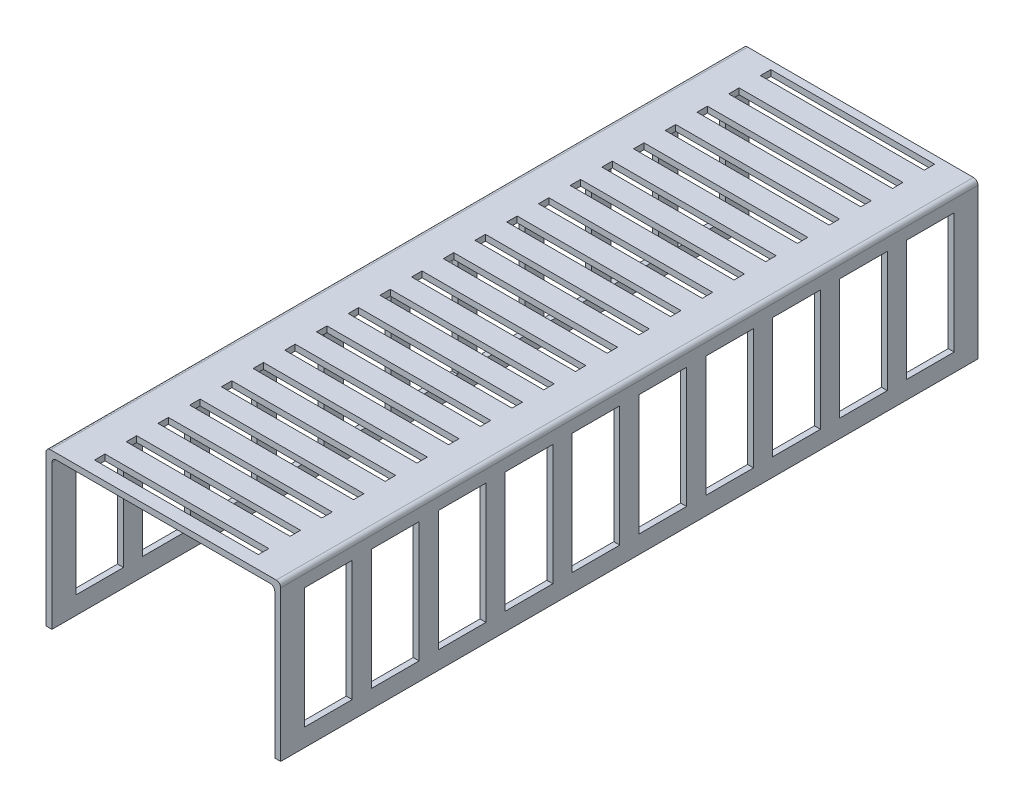
from build123d import *

# Parameters (mm, degrees)
SKETCH2_W           = 78.8
SKETCH2_H           = 234.1
SKETCH2_W_2         = 55
SKETCH2_H_2         = 3.5
BOSS_EXTRUDE1_DEPTH = 2
SKETCH3_W           = 2
SKETCH3_H           = 234.1
BOSS_EXTRUDE2_DEPTH = 50
FILLET1_R           = 1.5
SKETCH4_W           = 16
SKETCH4_H           = 40.5
CUT_EXTRUDE1_DEPTH  = 16103.800045703


with BuildPart() as part:
    # Sketch2 → Boss-Extrude1 (new body)
    with BuildSketch(Plane(origin=(0, 16100.049263041, 0), x_dir=(1, 0, 0), z_dir=(0, 1, 0))):
        with Locations((-7.2, 17)):
            Rectangle(SKETCH2_W, SKETCH2_H)
        with Locations((-7.2, 119.004761905)):
            Rectangle(SKETCH2_W_2, SKETCH2_H_2, mode=Mode.SUBTRACT)
        with Locations((-7.2, 129.65)):
            Rectangle(SKETCH2_W_2, SKETCH2_H_2, mode=Mode.SUBTRACT)
        with Locations((-7.2, 108.35952381)):
            Rectangle(SKETCH2_W_2, SKETCH2_H_2, mode=Mode.SUBTRACT)
        with Locations((-7.2, 97.714285714)):
            Rectangle(SKETCH2_W_2, SKETCH2_H_2, mode=Mode.SUBTRACT)
        with Locations((-7.2, 87.069047619)):
            Rectangle(SKETCH2_W_2, SKETCH2_H_2, mode=Mode.SUBTRACT)
        with Locations((-7.2, 76.423809524)):
            Rectangle(SKETCH2_W_2, SKETCH2_H_2, mode=Mode.SUBTRACT)
        with Locations((-7.2, 65.778571429)):
            Rectangle(SKETCH2_W_2, SKETCH2_H_2, mode=Mode.SUBTRACT)
        with Locations((-7.2, 55.133333333)):
            Rectangle(SKETCH2_W_2, SKETCH2_H_2, mode=Mode.SUBTRACT)
        with Locations((-7.2, 44.488095238)):
            Rectangle(SKETCH2_W_2, SKETCH2_H_2, mode=Mode.SUBTRACT)
        with Locations((-7.2, 33.842857143)):
            Rectangle(SKETCH2_W_2, SKETCH2_H_2, mode=Mode.SUBTRACT)
        with Locations((-7.2, 23.197619048)):
            Rectangle(SKETCH2_W_2, SKETCH2_H_2, mode=Mode.SUBTRACT)
        with Locations((-7.2, 12.552380952)):
            Rectangle(SKETCH2_W_2, SKETCH2_H_2, mode=Mode.SUBTRACT)
        with Locations((-7.2, 1.907142857)):
            Rectangle(SKETCH2_W_2, SKETCH2_H_2, mode=Mode.SUBTRACT)
        with Locations((-7.2, -8.738095238)):
            Rectangle(SKETCH2_W_2, SKETCH2_H_2, mode=Mode.SUBTRACT)
        with Locations((-7.2, -19.383333333)):
            Rectangle(SKETCH2_W_2, SKETCH2_H_2, mode=Mode.SUBTRACT)
        with Locations((-7.2, -30.028571429)):
            Rectangle(SKETCH2_W_2, SKETCH2_H_2, mode=Mode.SUBTRACT)
        with Locations((-7.2, -40.673809524)):
            Rectangle(SKETCH2_W_2, SKETCH2_H_2, mode=Mode.SUBTRACT)
        with Locations((-7.2, -51.319047619)):
            Rectangle(SKETCH2_W_2, SKETCH2_H_2, mode=Mode.SUBTRACT)
        with Locations((-7.2, -61.964285714)):
            Rectangle(SKETCH2_W_2, SKETCH2_H_2, mode=Mode.SUBTRACT)
        with Locations((-7.2, -72.60952381)):
            Rectangle(SKETCH2_W_2, SKETCH2_H_2, mode=Mode.SUBTRACT)
        with Locations((-7.2, -83.254761905)):
            Rectangle(SKETCH2_W_2, SKETCH2_H_2, mode=Mode.SUBTRACT)
        with Locations((-7.2, -93.9)):
            Rectangle(SKETCH2_W_2, SKETCH2_H_2, mode=Mode.SUBTRACT)
    extrude(amount=BOSS_EXTRUDE1_DEPTH)

    # Sketch3 → Boss-Extrude2 (add)
    with BuildSketch(Plane.XZ.offset(-16100.049263041)):
        with Locations((-45.6, -17)):
            Rectangle(SKETCH3_W, SKETCH3_H)
        with Locations((31.2, -17)):
            Rectangle(SKETCH3_W, SKETCH3_H)
    extrude(amount=BOSS_EXTRUDE2_DEPTH)

    # Fillet1
    fillet1_edges = [part.edges().sort_by_distance(p)[0] for p in [
        (32.2, 16102.049263041, -17),
        (-44.6, 16100.049263041, -17),
        (30.2, 16100.049263041, -17),
        (-46.6, 16102.049263041, -17),
    ]]
    fillet(fillet1_edges, radius=FILLET1_R)

    # Sketch4 → Cut-Extrude1 (cut, through all)
    with BuildSketch(Plane(origin=(32.2, 0, 0), x_dir=(0, 0, -1), z_dir=(1, 0, 0))):
        with Locations((-84.05, 16076.299263041)):
            Rectangle(SKETCH4_W, SKETCH4_H)
        with Locations((-61.594444444, 16076.299263041)):
            Rectangle(SKETCH4_W, SKETCH4_H)
        with Locations((-39.138888889, 16076.299263041)):
            Rectangle(SKETCH4_W, SKETCH4_H)
        with Locations((-16.683333333, 16076.299263041)):
            Rectangle(SKETCH4_W, SKETCH4_H)
        with Locations((5.772222222, 16076.299263041)):
            Rectangle(SKETCH4_W, SKETCH4_H)
        with Locations((28.227777778, 16076.299263041)):
            Rectangle(SKETCH4_W, SKETCH4_H)
        with Locations((50.683333333, 16076.299263041)):
            Rectangle(SKETCH4_W, SKETCH4_H)
        with Locations((73.138888889, 16076.299263041)):
            Rectangle(SKETCH4_W, SKETCH4_H)
        with Locations((95.594444444, 16076.299263041)):
            Rectangle(SKETCH4_W, SKETCH4_H)
        with Locations((118.05, 16076.299263041)):
            Rectangle(SKETCH4_W, SKETCH4_H)
    extrude(amount=-CUT_EXTRUDE1_DEPTH, mode=Mode.SUBTRACT)


solid = part.part
